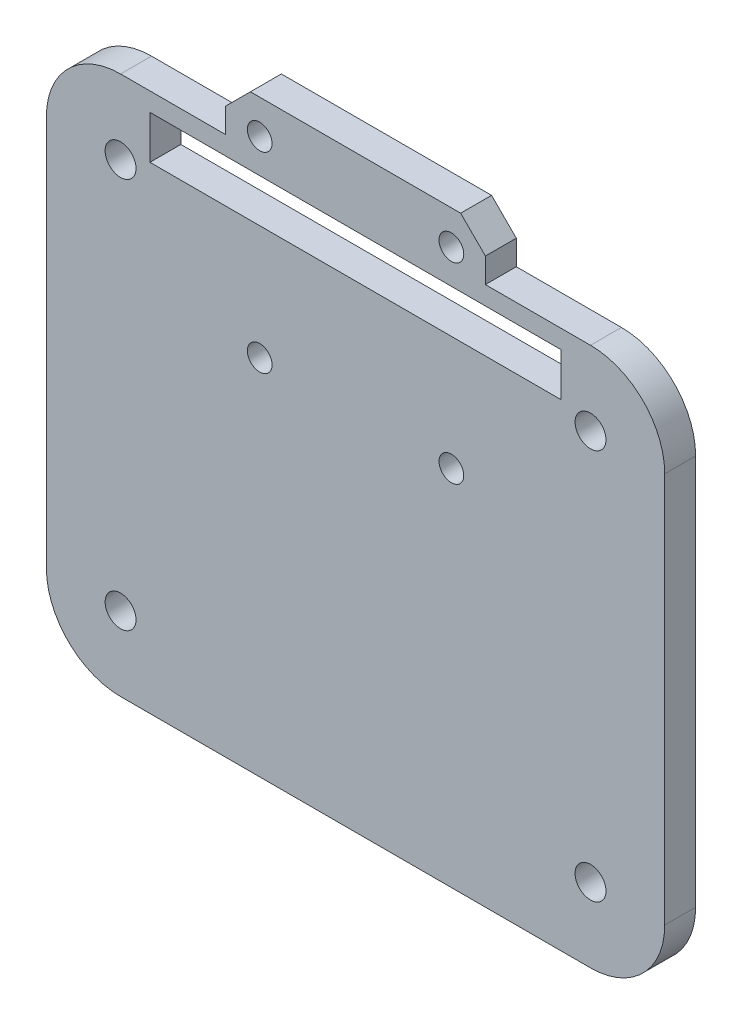
from build123d import *

# Parameters (mm, degrees)
Y_KSEKLIK_EKSTR_ZYON1_DEPTH = 5
IZIM2_R                     = 2.5
IZIM2_R_2                   = 2
KES_EKSTR_ZYON1_DEPTH       = 10
IZIM4_W                     = 66.5
IZIM4_H                     = 7
KES_EKSTR_ZYON3_DEPTH       = 5
RADYUS1_R                   = 12


with BuildPart() as part:
    # Çizim1 → Yükseklik-Ekstrüzyon1 (new body)
    with BuildSketch(Plane.XY):
        Polygon((21, 43.6), (50, 43.6), (50, -43.6), (-50, -43.6), (-50, 43.6), (-21, 43.6), (-21, 47.6), (-17, 51.6), (17, 51.6), (21, 47.6), align=None)
    extrude(amount=Y_KSEKLIK_EKSTR_ZYON1_DEPTH)

    # Çizim2 → Kes-Ekstrüzyon1 (cut)
    with BuildSketch(Plane.XY.offset(5)):
        with Locations((38, -31.6)):
            Circle(IZIM2_R)
        with Locations((38, 31.6)):
            Circle(IZIM2_R)
        with Locations((-15.5, 46.1)):
            Circle(IZIM2_R_2)
        with Locations((15.5, 46.1)):
            Circle(IZIM2_R_2)
        with Locations((15.5, 15.1)):
            Circle(IZIM2_R_2)
        with Locations((-15.5, 15.1)):
            Circle(IZIM2_R_2)
        with Locations((-38, 31.6)):
            Circle(IZIM2_R)
        with Locations((-38, -31.6)):
            Circle(IZIM2_R)
    extrude(amount=-KES_EKSTR_ZYON1_DEPTH, mode=Mode.SUBTRACT)

    # Çizim4 → Kes-Ekstrüzyon3 (cut)
    with BuildSketch(Plane.XY.offset(5)):
        with Locations((0, 37.1)):
            Rectangle(IZIM4_W, IZIM4_H)
    extrude(amount=-KES_EKSTR_ZYON3_DEPTH, mode=Mode.SUBTRACT)

    # Radyus1
    radyus1_edges = [part.edges().sort_by_distance(p)[0] for p in [
        (50, -43.6, 2.5),
        (-50, -43.6, 2.5),
        (-50, 43.6, 2.5),
        (50, 43.6, 2.5),
    ]]
    fillet(radyus1_edges, radius=RADYUS1_R)


solid = part.part
